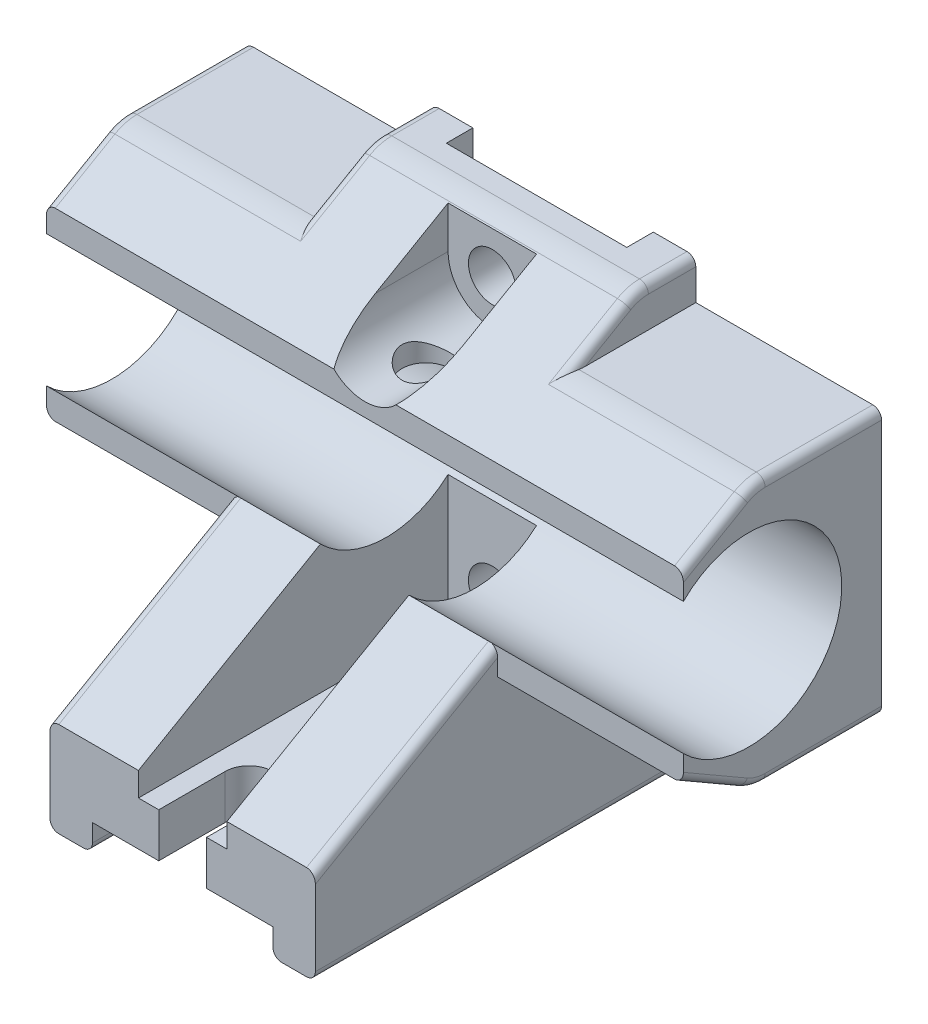
from build123d import *
from build123d.topology import SkipClean

# Parameters (mm, degrees)
BOSS_EXTRUDE1_DEPTH = 15
BOSS_EXTRUDE2_DEPTH = 21
SKETCH4_W           = 10.2
SKETCH4_H           = 2.9999999999999964
CUT_EXTRUDE1_DEPTH  = 62.298960023804646
SKETCH9_R           = 10.5
CUT_EXTRUDE6_DEPTH  = 62.298960023804646
SKETCH5_W           = 10.2
SKETCH5_H           = 3
CUT_EXTRUDE2_DEPTH  = 73.85087508053697
BOSS_EXTRUDE4_REACH = 51.095
SKETCH10_W          = 5
SKETCH10_H          = 5.5837661042678555
CUT_EXTRUDE7_DEPTH  = 5
SKETCH6_R           = 2.7
CUT_EXTRUDE3_DEPTH  = 14.4
CUT_EXTRUDE4_DEPTH  = 50.09503539055656
SKETCH8_W           = 5
SKETCH8_H           = 16.75
CUT_EXTRUDE5_DEPTH  = 35
SKETCH12_R          = 2.7
CUT_EXTRUDE8_DEPTH  = 5
SKETCH13_R          = 2.7
CUT_EXTRUDE9_DEPTH  = 75.801403730144
FILLET1_R           = 5
FILLET2_R           = 1


with BuildPart() as part:
    # Sketch2 → Boss-Extrude1 (new body)
    with BuildSketch(Plane(origin=(0, 0, 0), x_dir=(0, 0, -1), z_dir=(1, 0, 0))):
        Polygon((0, 24.75), (-6.7, 24.75), (-22.4, 15.685600773722843), (-22.399999999999995, -2.156584454693771), (-43, -14.050000000000002), (-43, -24.75), (0, -24.75), align=None)
    extrude(amount=BOSS_EXTRUDE1_DEPTH)

    # Sketch3 → Boss-Extrude2 (add)
    with BuildSketch(Plane(origin=(15, 0, 0), x_dir=(0, 0, -1), z_dir=(1, 0, 0))):
        Polygon((-22.4, 15.685600773722843), (-22.4, -5.192264973080983), (-14.5, -9.753332099679069), (0, -9.753332099679069), (0, 20.246667900320933), (-14.5, 20.246667900320933), align=None)
    extrude(amount=BOSS_EXTRUDE2_DEPTH)

    # Sketch4 → Cut-Extrude1 (cut, through all)
    with BuildSketch(Plane.XY.offset(43)):
        with Locations((5.1, -23.25)):
            Rectangle(SKETCH4_W, SKETCH4_H)
    extrude(amount=-CUT_EXTRUDE1_DEPTH, mode=Mode.SUBTRACT)

    # Sketch9 → Cut-Extrude6 (cut, through all)
    with BuildSketch(Plane(origin=(36.00000000000001, 0, 0), x_dir=(0, 0, -1), z_dir=(1, 0, 0))):
        with Locations((-15, 5.24666790032093)):
            Circle(SKETCH9_R)
    extrude(amount=-CUT_EXTRUDE6_DEPTH, mode=Mode.SUBTRACT)

    # Sketch5 → Cut-Extrude2 (cut, through all)
    with BuildSketch(Plane.XZ.offset(21.750000000000004)):
        with Locations((5.1, 1.5)):
            Rectangle(SKETCH5_W, SKETCH5_H)
    extrude(amount=-CUT_EXTRUDE2_DEPTH, mode=Mode.SUBTRACT)

    # Boss-Extrude4: up to this face of the body (flat: up to its plane)
    boss_extrude4_end = Plane(part.part.faces().sort_by_distance((5.1, 1.5, 3))[0])
    # Sketch10 → Boss-Extrude4 (add, up to the picked face)
    with BuildSketch(Plane.XY.offset(22.399999999999995), mode=Mode.PRIVATE) as boss_extrude4_sk1:
        with Locations((2.5, 15.48771197904034)):
            Rectangle(SKETCH10_W, SKETCH10_H)
    boss_extrude4_tool1 = split(extrude(boss_extrude4_sk1.sketch, amount=-BOSS_EXTRUDE4_REACH, mode=Mode.PRIVATE), bisect_by=boss_extrude4_end, keep=Keep.BOTH, mode=Mode.PRIVATE)
    add(boss_extrude4_tool1.solids().sort_by(Axis((2.5, 15.487712, 22.4), (0, 0, -1)))[0])

    # Sketch11 → Cut-Extrude7 (cut)
    with BuildSketch(Plane(origin=(5, 0, 0), x_dir=(0, 0, -1), z_dir=(1, 0, 0))):
        Polygon((-22.399999999999995, 15.685600773722847), (-17.907070151552254, 18.279595031174264), (-22.399999999999995, 18.279595031174264), align=None)
    extrude(amount=-CUT_EXTRUDE7_DEPTH, mode=Mode.SUBTRACT)

    # Sketch6 → Cut-Extrude3 (cut)
    with BuildSketch(Plane.XY.offset(22.399999999999995)):
        with BuildLine():
            Line((5, 19.250000000000004), (5.000000000000001, 24.750000000000004))
            Line((5.000000000000001, 24.750000000000004), (-5, 24.750000000000004))
            Line((-5, 24.750000000000004), (-5, 19.250000000000004))
            ThreePointArc((-5, 19.250000000000004), (-9.2e-16, 14.250000000000004), (5, 19.250000000000004))
        make_face()
        with Locations((0, 19.250000000000004)):
            Circle(SKETCH6_R, mode=Mode.SUBTRACT)
    extrude(amount=-CUT_EXTRUDE3_DEPTH, mode=Mode.SUBTRACT)

    # Sketch7 → Cut-Extrude4 (cut, through all)
    with BuildSketch(Plane.XY.offset(22.399999999999995)):
        with BuildLine():
            Line((0, 21.950000000000006), (0, 16.549999999999997))
            ThreePointArc((0, 16.549999999999997), (2.7000000000000064, 19.250000000000004), (0, 21.950000000000006))
        make_face()
    extrude(amount=-CUT_EXTRUDE4_DEPTH, mode=Mode.SUBTRACT)

    # Sketch8 → Cut-Extrude5 (cut)
    with BuildSketch(Plane.XY.offset(43)):
        with Locations((2.5, -8.375)):
            Rectangle(SKETCH8_W, SKETCH8_H)
    extrude(amount=-CUT_EXTRUDE5_DEPTH, mode=Mode.SUBTRACT)

    # Sketch12 → Cut-Extrude8 (cut)
    with BuildSketch(Plane.XY.offset(8)):
        with Locations((0, -11.750000000000002)):
            Circle(SKETCH12_R)
    extrude(amount=-CUT_EXTRUDE8_DEPTH, mode=Mode.SUBTRACT)

    # Sketch13 → Cut-Extrude9 (cut, through all)
    with BuildSketch(Plane(origin=(0, 24.75, 0), x_dir=(1, 0, 0), z_dir=(0, 1, 0))):
        with Locations((0, -15.5)):
            Circle(SKETCH13_R)
        with BuildLine():
            Line((2.7, -35.5), (2.7000000000000006, -43))
            Line((2.7000000000000006, -43), (-2.7000000000000006, -43))
            Line((-2.7000000000000006, -43), (-2.7, -35.5))
            ThreePointArc((-2.7, -35.5), (1.7e-16, -32.8), (2.7, -35.5))
        make_face()
    extrude(amount=-CUT_EXTRUDE9_DEPTH, mode=Mode.SUBTRACT)

    # Fillet1
    fillet1_edges = [part.edges().sort_by_distance(p)[0] for p in [
        (25.5, 20.246667900320933, 14.5),
        (25.5, -9.753332099679069, 14.5),
        (7.5, 24.75, 6.7),
    ]]
    fillet(fillet1_edges, radius=FILLET1_R)

    # Fillet2
    fillet2_edges = [part.edges().sort_by_distance(p)[0] for p in [
        (15, 24.75, 2.6801270189221915),
        (15, 24.57962913144534, 6.654349263356993),
        (36, 20.246667900320933, 6.580127018922168),
        (36, 20.07629703176627, 14.454349263356942),
        (36, -9.753332099679069, 6.5801270189221865),
        (36, -9.582961231124408, 14.454349263356988),
        (15, 21.828460969082656, 11.760254037844366),
        (36, 17.63119784648299, 19.030127018922176),
        (36, -7.137862045841118, 19.030127018922194),
        (10.2, -24.75, 21.5),
        (15, -24.75, 21.5),
        (15, -8.11170848370516, 32.71457738362205),
    ]]
    fillet(fillet2_edges, radius=FILLET2_R)

    # Mirror1: part across plane


with BuildPart() as part_1:
    with SkipClean():  # the faces are left unmerged after this step: merging them gives an invalid solid
        add(part.part)
        add(part.part.mirror(Plane(origin=(0, 0, 0), x_dir=(0, 0, 1), z_dir=(1, 0, 0))))


solid = part_1.part
